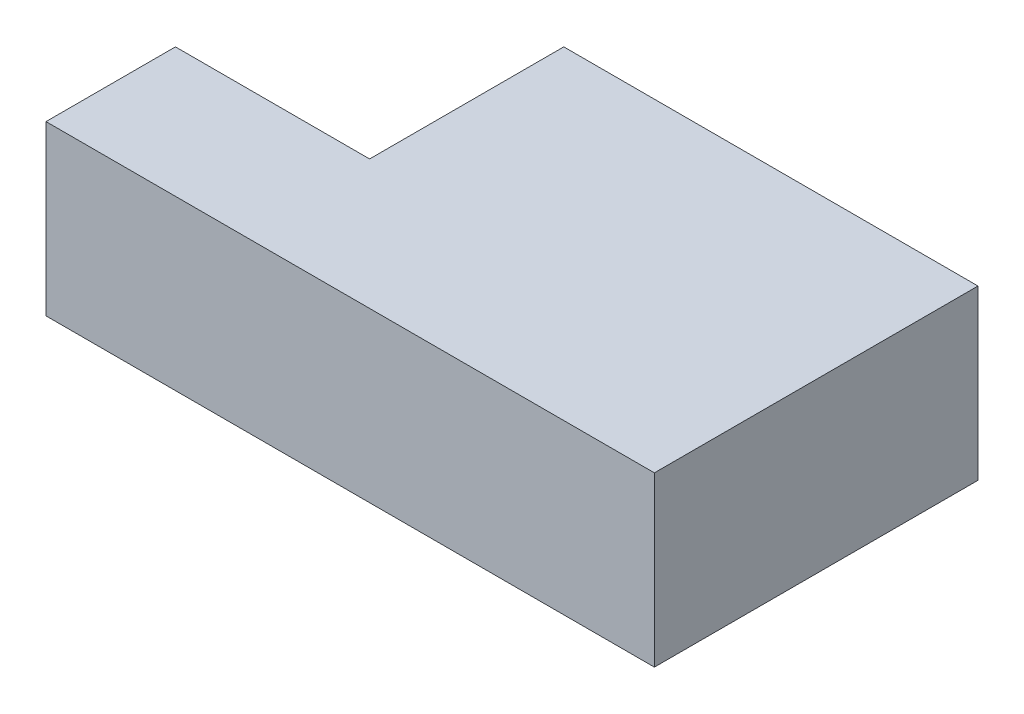
from build123d import *

# Parameters (mm, degrees)
EXTRUDE_1_DEPTH     = 13
CUT_EXTRUDE_1_DEPTH = 11


with BuildPart() as part:
    # 草图1 → 凸台-拉伸1 (new body)
    with BuildSketch(Plane(origin=(0, 0, 0), x_dir=(1, 0, 0), z_dir=(0, 1, 0))):
        Polygon((0, 0), (0, 25), (-32, 25), (-32, 10), (-47, 10), (-47, 0), align=None)
    extrude(amount=EXTRUDE_1_DEPTH)

    # 草图2 → 切除-拉伸1 (cut)
    with BuildSketch(Plane.XZ):
        Polygon((-2, -2), (-45, -2), (-45, -8), (-30, -8), (-30, -23), (-2, -23), align=None)
    extrude(amount=-CUT_EXTRUDE_1_DEPTH, mode=Mode.SUBTRACT)


solid = part.part
